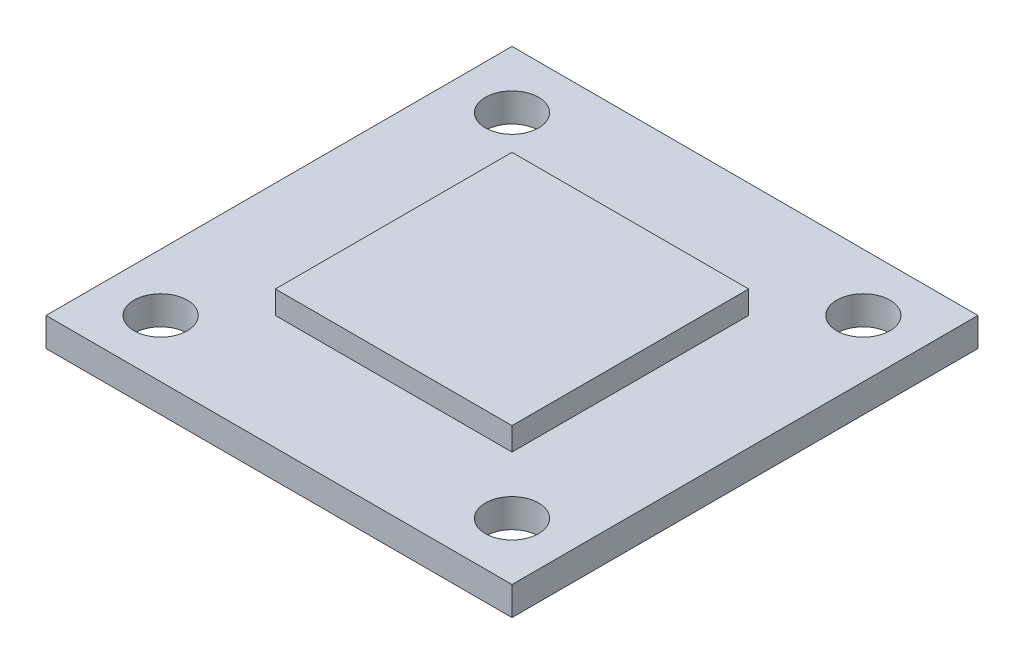
from build123d import *

# Parameters (mm, degrees)
SKETCH1_W                   = 25.8064
SKETCH1_H                   = 25.8064
BOSS_EXTRUDE1_DEPTH         = 1.5875
SKETCH2_W                   = 13.1064
SKETCH2_H                   = 13.1064
BOSS_EXTRUDE2_DEPTH         = 1.27
F_32_0_116_DIAMETER_HOLE1_D = 2.9464


with BuildPart() as part:
    # Sketch1 → Boss-Extrude1 (new body)
    with BuildSketch(Plane(origin=(0, 0, 0), x_dir=(1, 0, 0), z_dir=(0, 1, 0))):
        Rectangle(SKETCH1_W, SKETCH1_H)
    extrude(amount=BOSS_EXTRUDE1_DEPTH)

    # Sketch2 → Boss-Extrude2 (add)
    with BuildSketch(Plane(origin=(0, 1.5875, 0), x_dir=(1, 0, 0), z_dir=(0, 1, 0))):
        Rectangle(SKETCH2_W, SKETCH2_H)
    extrude(amount=BOSS_EXTRUDE2_DEPTH)

    # #32 (0.116) Diameter Hole1 (through all)
    with Locations(Plane(origin=(-9.7282, 1.5875, -9.7282), x_dir=(0, 0, 1), z_dir=(0, 1, 0))):
        with Locations((0, 0), (19.4564, 0), (19.4564, 19.4564), (0, 19.4564)):
            Hole(F_32_0_116_DIAMETER_HOLE1_D / 2)


solid = part.part
